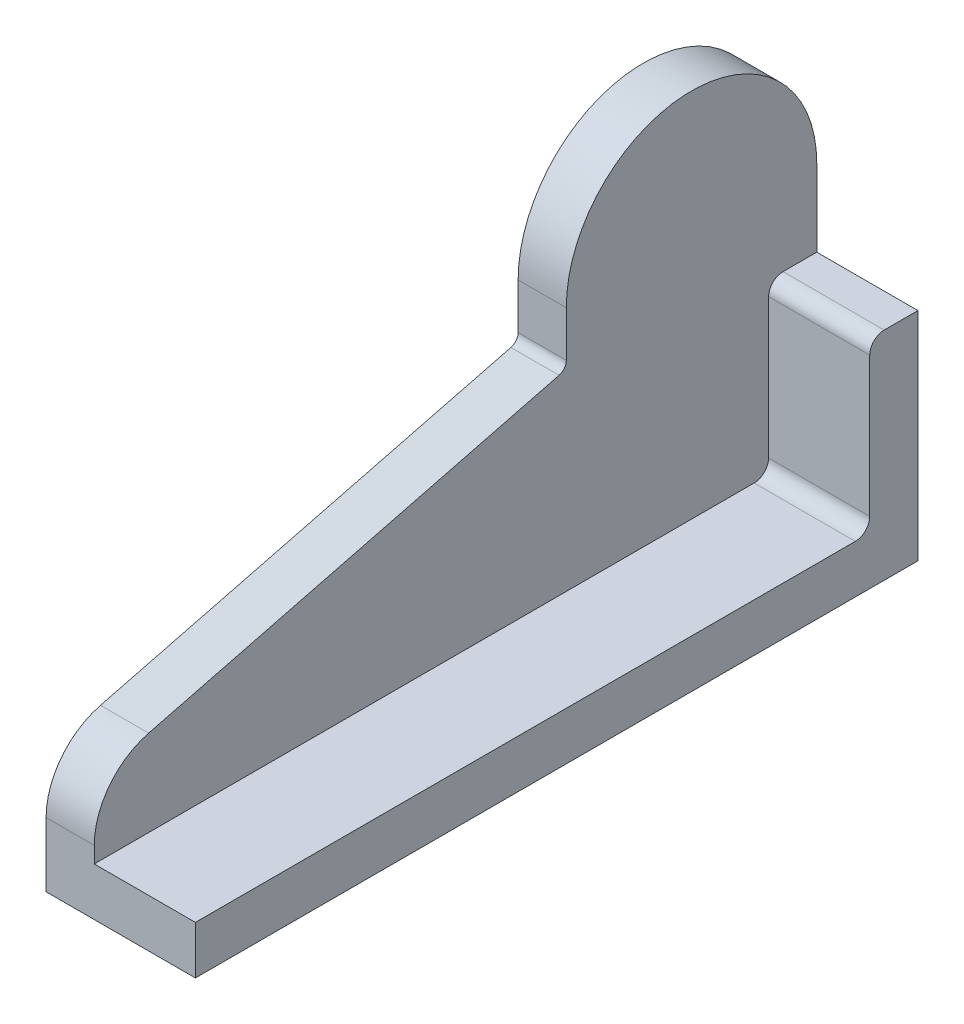
from build123d import *

# Parameters (mm, degrees)
SKETCH1_W                = 82
SKETCH1_H                = 150
BOSS_EXTRUDE1_DEPTH      = 10
SKETCH2_W                = 10
SKETCH2_H                = 45
BOSS_EXTRUDE2_DEPTH      = 82
BOSS_EXTRUDE3_DEPTH      = 42
BOSS_EXTRUDE3_DEPTH_BACK = 10
FILLET3_RADIUS           = 26
FILLET3_LENGTH           = 10
FILLET4_RADIUS           = 26
FILLET4_LENGTH           = 10
BOSS_EXTRUDE4_DEPTH      = 10
BOSS_EXTRUDE5_DEPTH      = 10
FILLET5_R                = 15
FILLET6_R                = 15
SKETCH6_R                = 8
SKETCH6_R_2              = 5.5
CUT_EXTRUDE1_DEPTH       = 131.057679512
FILLET7_R                = 3
FILLET8_R                = 3
FILLET9_R                = 3
FILLET10_R               = 3
FILLET11_R               = 2
SKETCH7_R                = 5.5
CUT_EXTRUDE2_DEPTH       = 116.043470045
SKETCH8_W                = 181.068808942
SKETCH8_H                = 99.289789265
CUT_EXTRUDE3_DEPTH       = 126.678160394
SKETCH9_W                = 17.116284166
SKETCH9_H                = 92.331504729
BOSS_EXTRUDE6_DEPTH      = 10
SKETCH10_W               = 23.658167423
SKETCH10_H               = 25.148445686
SKETCH10_W_2             = 13.971358715
SKETCH10_H_2             = 14.716497846
BOSS_EXTRUDE7_DEPTH      = 10


with BuildPart() as part:
    # Sketch1 → Boss-Extrude1 (new body)
    with BuildSketch(Plane(origin=(0, 0, 0), x_dir=(1, 0, 0), z_dir=(0, 1, 0))):
        Rectangle(SKETCH1_W, SKETCH1_H)
    extrude(amount=BOSS_EXTRUDE1_DEPTH)

    # Sketch2 → Boss-Extrude2 (add, through all)
    with BuildSketch(Plane(origin=(41, 0, 0), x_dir=(0, 0, -1), z_dir=(1, 0, 0))):
        with Locations((70, 22.5)):
            Rectangle(SKETCH2_W, SKETCH2_H)
    extrude(amount=-BOSS_EXTRUDE2_DEPTH)

    # Sketch3 → Boss-Extrude3 (add, two sides: drawn at the far end of the back side and taken through both)
    with BuildSketch(Plane.XY.offset(-65).offset(-BOSS_EXTRUDE3_DEPTH_BACK)):
        Polygon((10, 45), (10, 10), (20, 10), (20, 45), (20, 87), (10, 87), align=None)
        Polygon((-10, 45), (-10, 87), (-20, 87), (-20, 45), (-20, 10), (-10, 10), align=None)
    extrude(amount=BOSS_EXTRUDE3_DEPTH + BOSS_EXTRUDE3_DEPTH_BACK)

    # Fillet3: full round fillet: the end face becomes a half cylinder, R = half its width
    fillet3_face = Plane((15, 87, -49), x_dir=(-1, 0, 0), z_dir=(0, 1, 0))  # on the end face: x along it, z out of the body
    fillet3_slab = fillet3_face.offset(-FILLET3_RADIUS / 2) * Box(FILLET3_LENGTH, 2 * FILLET3_RADIUS, FILLET3_RADIUS, mode=Mode.PRIVATE)  # the body's end, R deep
    fillet3_round = Plane((15, 61, -49), x_dir=(0, 1, 0), z_dir=(-1, 0, 0)) * Cylinder(FILLET3_RADIUS, FILLET3_LENGTH, mode=Mode.PRIVATE)  # its axis R under the face
    add(fillet3_slab - fillet3_round, mode=Mode.SUBTRACT)

    # Fillet4: full round fillet: the end face becomes a half cylinder, R = half its width
    fillet4_face = Plane((-15, 87, -49), x_dir=(-1, 0, 0), z_dir=(0, 1, 0))  # on the end face: x along it, z out of the body
    fillet4_slab = fillet4_face.offset(-FILLET4_RADIUS / 2) * Box(FILLET4_LENGTH, 2 * FILLET4_RADIUS, FILLET4_RADIUS, mode=Mode.PRIVATE)  # the body's end, R deep
    fillet4_round = Plane((-15, 61, -49), x_dir=(0, 1, 0), z_dir=(-1, 0, 0)) * Cylinder(FILLET4_RADIUS, FILLET4_LENGTH, mode=Mode.PRIVATE)  # its axis R under the face
    add(fillet4_slab - fillet4_round, mode=Mode.SUBTRACT)

    # Sketch4 → Boss-Extrude4 (add)
    with BuildSketch(Plane(origin=(20, 0, 0), x_dir=(0, 0, -1), z_dir=(1, 0, 0))):
        Polygon((23, 10), (23, 50), (-75, 25), (-75, 10), align=None)
    extrude(amount=-BOSS_EXTRUDE4_DEPTH)

    # Sketch5 → Boss-Extrude5 (add)
    with BuildSketch(Plane.ZY.offset(20)):
        Polygon((-23, 50), (75, 25), (75, 10), (-23, 10), align=None)
    extrude(amount=-BOSS_EXTRUDE5_DEPTH)

    # Fillet5
    fillet5_edges = [part.edges().sort_by_distance(p)[0] for p in [
        (15, 25, 75),
    ]]
    fillet(fillet5_edges, radius=FILLET5_R)

    # Fillet6
    fillet6_edges = [part.edges().sort_by_distance(p)[0] for p in [
        (-15, 25, 75),
    ]]
    fillet(fillet6_edges, radius=FILLET6_R)

    # Sketch6 → Cut-Extrude1 (cut, through all)
    with BuildSketch(Plane(origin=(20, 0, 0), x_dir=(0, 0, -1), z_dir=(1, 0, 0))):
        with Locations((49, 61)):
            Circle(SKETCH6_R)
        with Locations((-60, 17.5)):
            Circle(SKETCH6_R_2)
    extrude(amount=-CUT_EXTRUDE1_DEPTH, mode=Mode.SUBTRACT)

    # Fillet7
    fillet7_edges = [part.edges().sort_by_distance(p)[0] for p in [
        (30.5, 45, -65),
    ]]
    fillet(fillet7_edges, radius=FILLET7_R)

    # Fillet8
    fillet8_edges = [part.edges().sort_by_distance(p)[0] for p in [
        (0, 45, -65),
    ]]
    fillet(fillet8_edges, radius=FILLET8_R)

    # Fillet9
    fillet9_edges = [part.edges().sort_by_distance(p)[0] for p in [
        (-30.5, 45, -65),
    ]]
    fillet(fillet9_edges, radius=FILLET9_R)

    # Fillet10
    fillet10_edges = [part.edges().sort_by_distance(p)[0] for p in [
        (30.5, 10, -65),
        (0, 10, -65),
        (-30.5, 10, -65),
    ]]
    fillet(fillet10_edges, radius=FILLET10_R)

    # Fillet11
    fillet11_edges = [part.edges().sort_by_distance(p)[0] for p in [
        (15, 50, -23),
        (-15, 50, -23),
    ]]
    fillet(fillet11_edges, radius=FILLET11_R)

    # Sketch7 → Cut-Extrude2 (cut, through all)
    with BuildSketch(Plane(origin=(0, 10, 0), x_dir=(1, 0, 0), z_dir=(0, 1, 0))):
        with Locations(Location((31.5, 45, 0), (0, 0, 270))):
            Circle(SKETCH7_R)
        with Locations(Location((31.5, -15, 0), (0, 0, 270))):
            Circle(SKETCH7_R)
        with Locations(Location((-31.5, -15, 0), (0, 0, 90))):
            Circle(SKETCH7_R)
        with Locations(Location((-31.5, 45, 0), (0, 0, 90))):
            Circle(SKETCH7_R)
    extrude(amount=-CUT_EXTRUDE2_DEPTH, mode=Mode.SUBTRACT)

    # Sketch8 → Cut-Extrude3 (cut, through all)
    with BuildSketch(Plane.ZY.offset(-10)):
        with Locations((1.490278263, 42.723870649)):
            Rectangle(SKETCH8_W, SKETCH8_H)
    extrude(amount=CUT_EXTRUDE3_DEPTH, mode=Mode.SUBTRACT)

    # Sketch9 → Boss-Extrude6 (add, through all)
    with BuildSketch(Plane(origin=(0, 10, 0), x_dir=(1, 0, 0), z_dir=(0, 1, 0))):
        with Locations((30.200951285, 11.209960756)):
            Rectangle(SKETCH9_W, SKETCH9_H)
    extrude(amount=-BOSS_EXTRUDE6_DEPTH)

    # Sketch10 → Boss-Extrude7 (add)
    with BuildSketch(Plane.ZY.offset(-10)):
        with Locations((-48.340901153, 61.662766329)):
            Rectangle(SKETCH10_W, SKETCH10_H)
        with Locations((59.331703342, 16.768133659)):
            Rectangle(SKETCH10_W_2, SKETCH10_H_2)
    extrude(amount=-BOSS_EXTRUDE7_DEPTH)


solid = part.part
